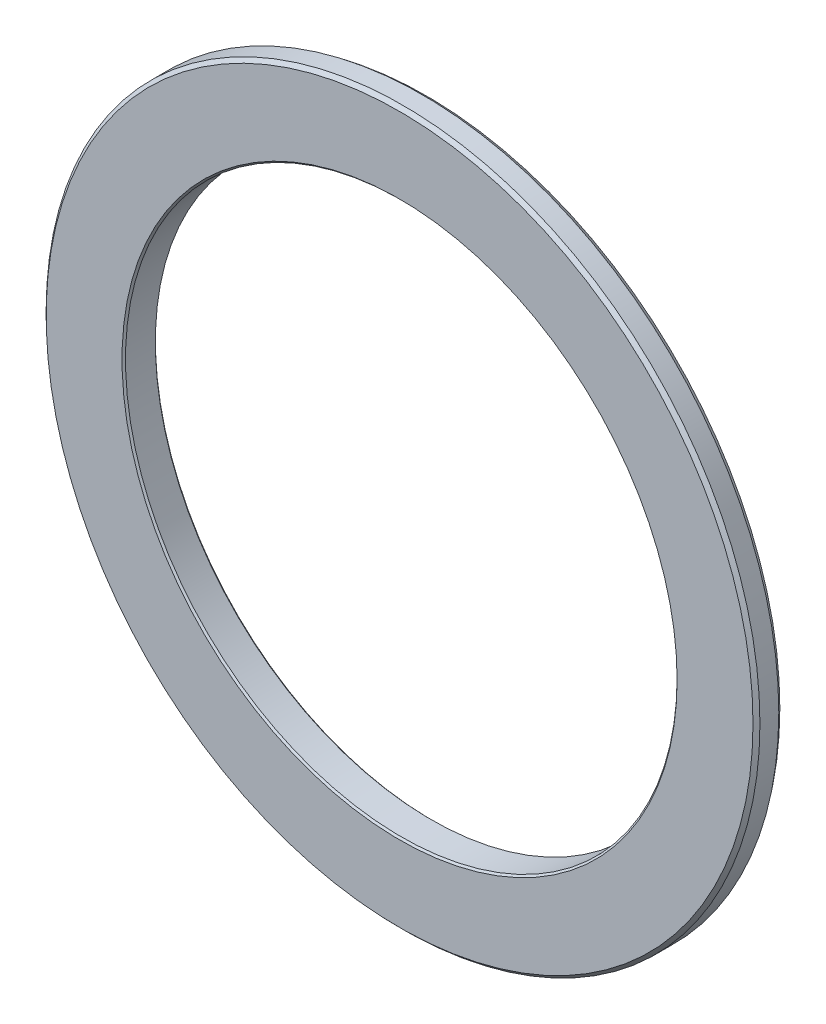
from build123d import *
from OCP.BRepFilletAPI import BRepFilletAPI_MakeChamfer

# Parameters (mm, degrees)
SKETCH_1_R      = 20.575
SKETCH_1_R_2    = 15.9
EXTRUDE_1_DEPTH = 1.92
CHAMFER_1_SIZE  = 3
CHAMFER_1_SIZE2 = 0.4
CHAMFER_2_SIZE  = 0.2
CHAMFER_2_SIZE2 = 0.232811476
CHAMFER_3_SIZE  = 0.1


with BuildPart() as part:
    # Эскиз1 → Бобышка-Вытянуть1 (new body)
    with BuildSketch(Plane.XY):
        Circle(SKETCH_1_R)
        Circle(SKETCH_1_R_2, mode=Mode.SUBTRACT)
    extrude(amount=EXTRUDE_1_DEPTH)

    # Фаска1
    chamfer_1_edges = [part.edges().sort_by_distance(p)[0] for p in [
        (-20.575, 0, 0),
    ]]
    chamfer_1_side = [part.faces().sort_by_distance(p)[0] for p in [
        (-19.993051119, 0, 0),
    ]]
    chamfer(chamfer_1_edges, length=CHAMFER_1_SIZE, length2=CHAMFER_1_SIZE2, reference=chamfer_1_side[0])

    # Фаска2: one chamfer whose edges measure the first distance from different faces: ONE call of the kernel's chamfer builder (chamfer() names one face for all edges)
    chamfer_2_edges_1 = [part.edges().sort_by_distance(p)[0] for p in [
        (-20.575, 0, 1.92),
    ]]
    chamfer_2_edges_2 = [part.edges().sort_by_distance(p)[0] for p in [
        (-20.575, 0, 0.4),
    ]]
    chamfer_2_side_2 = [part.faces().sort_by_distance(p)[0] for p in [
        (-19.075, 0, 0.2),
    ]]
    chamfer_2 = BRepFilletAPI_MakeChamfer(part.part.solid().wrapped)
    for e in chamfer_2_edges_1:
        chamfer_2.Add(CHAMFER_2_SIZE, e.wrapped)
    for e in chamfer_2_edges_2:
        chamfer_2.Add(CHAMFER_2_SIZE, CHAMFER_2_SIZE2, e.wrapped, chamfer_2_side_2[0].wrapped)  # the first distance lies on this face
    add(Compound.cast(chamfer_2.Shape()), mode=Mode.REPLACE)

    # Фаска3
    chamfer_3_edges = [part.edges().sort_by_distance(p)[0] for p in [
        (-15.9, 0, 0),
        (-15.9, 0, 1.92),
    ]]
    chamfer(chamfer_3_edges, length=CHAMFER_3_SIZE)


solid = part.part
